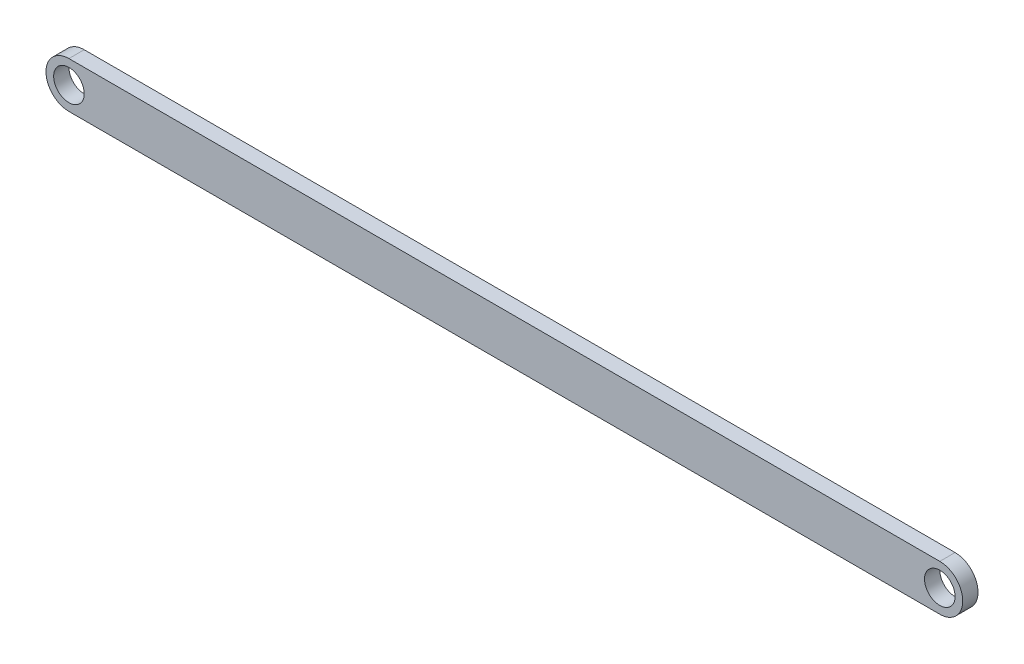
from build123d import *

# Parameters (mm, degrees)
SKETCH_1_R      = 10
EXTRUDE_1_DEPTH = 10


with BuildPart() as part:
    # Эскиз1 → Бобышка-Вытянуть1 (new body)
    with BuildSketch(Plane.XY):
        with BuildLine():
            Line((0, 15), (570, 15))
            ThreePointArc((570, 15), (585, 0), (570, -15))
            Line((570, -15), (0, -15))
            ThreePointArc((0, -15), (-15, 0), (0, 15))
        make_face()
        Circle(SKETCH_1_R, mode=Mode.SUBTRACT)
        with Locations((570, 0)):
            Circle(SKETCH_1_R, mode=Mode.SUBTRACT)
    extrude(amount=EXTRUDE_1_DEPTH)


solid = part.part
